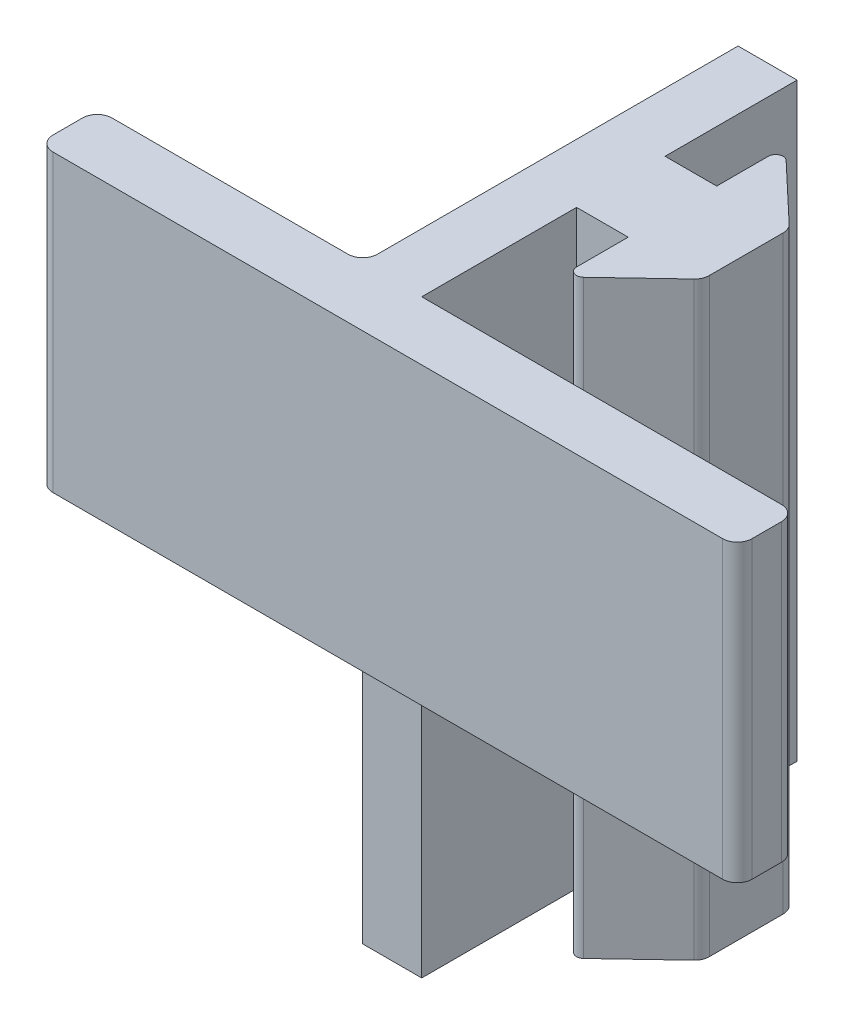
from build123d import *

# Parameters (mm, degrees)
MAIN_EXTRUDE_DEPTH = 40
FILLET1_R          = 1
FILLET2_R          = 1
FILLET3_R          = 1
CUT_EXTRUDE1_DEPTH = 20


with BuildPart() as part:
    # Sketch1 → Main-Extrude (new body)
    with BuildSketch(Plane(origin=(0, 0, 0), x_dir=(1, 0, 0), z_dir=(0, 1, 0))):
        with BuildLine():
            Line((6.5, 11.159541063), (6.5, 7.659541063))
            ThreePointArc((6.5, 7.659541063), (6.80229201, 7.200289987), (7.343646203, 7.296350635))
            Line((7.343646203, 7.296350635), (11.187292407, 10.933160207))
            ThreePointArc((11.187292407, 10.933160207), (11.418502152, 11.264125084), (11.5, 11.659541063))
            Line((11.5, 11.659541063), (11.5, 16.659541063))
            ThreePointArc((11.5, 16.659541063), (11.418502152, 17.054957042), (11.187292407, 17.385921919))
            Line((11.187292407, 17.385921919), (7.343646203, 21.022731491))
            ThreePointArc((7.343646203, 21.022731491), (6.80229201, 21.118792139), (6.5, 20.659541063))
            Line((6.5, 20.659541063), (6.5, 17.159541063))
            Line((6.5, 17.159541063), (3, 17.159541063))
            Line((3, 17.159541063), (3, 26.109541063))
            Line((3, 26.109541063), (-1, 26.109541063))
            Line((-1, 26.109541063), (-1, 0.659541063))
            Line((-1, 0.659541063), (-19, 0.659541063))
            Line((-19, 0.659541063), (-19, -3.340458937))
            Line((-19, -3.340458937), (-4.999912017, -3.340458937))
            Line((-4.999912017, -3.340458937), (28.4, -3.340458937))
            Line((28.4, -3.340458937), (28.4, 0.659541063))
            Line((28.4, 0.659541063), (3, 0.659541063))
            Line((3, 0.659541063), (3, 11.159541063))
            Line((3, 11.159541063), (6.5, 11.159541063))
        make_face()
    extrude(amount=MAIN_EXTRUDE_DEPTH)

    # Fillet1
    fillet1_edges = [part.edges().sort_by_distance(p)[0] for p in [
        (28.4, 20, 3.340458937),
        (-19, 20, 3.340458937),
        (28.4, 20, -0.659541063),
    ]]
    fillet(fillet1_edges, radius=FILLET1_R)

    # Fillet2
    fillet2_edges = [part.edges().sort_by_distance(p)[0] for p in [
        (-19, 20, -0.659541063),
    ]]
    fillet(fillet2_edges, radius=FILLET2_R)

    # Fillet3
    fillet3_edges = [part.edges().sort_by_distance(p)[0] for p in [
        (-1, 20, -0.659541063),
    ]]
    fillet(fillet3_edges, radius=FILLET3_R)

    # Sketch5 → Cut-Extrude1 (cut)
    with BuildSketch(Plane.XZ):
        Polygon((-19, -0.659541063), (-4.518354444, -0.659541063), (-4.518354444, -5.516455238), (-1, -5.516455238), (-1, -0.659541063), (3, -0.659541063), (3, -5.516455238), (6.594635696, -5.516455238), (6.594635696, -0.659541063), (28.4, -0.659541063), (28.4, 3.340458937), (-19, 3.340458937), align=None)
    extrude(amount=-CUT_EXTRUDE1_DEPTH, mode=Mode.SUBTRACT)


solid = part.part
